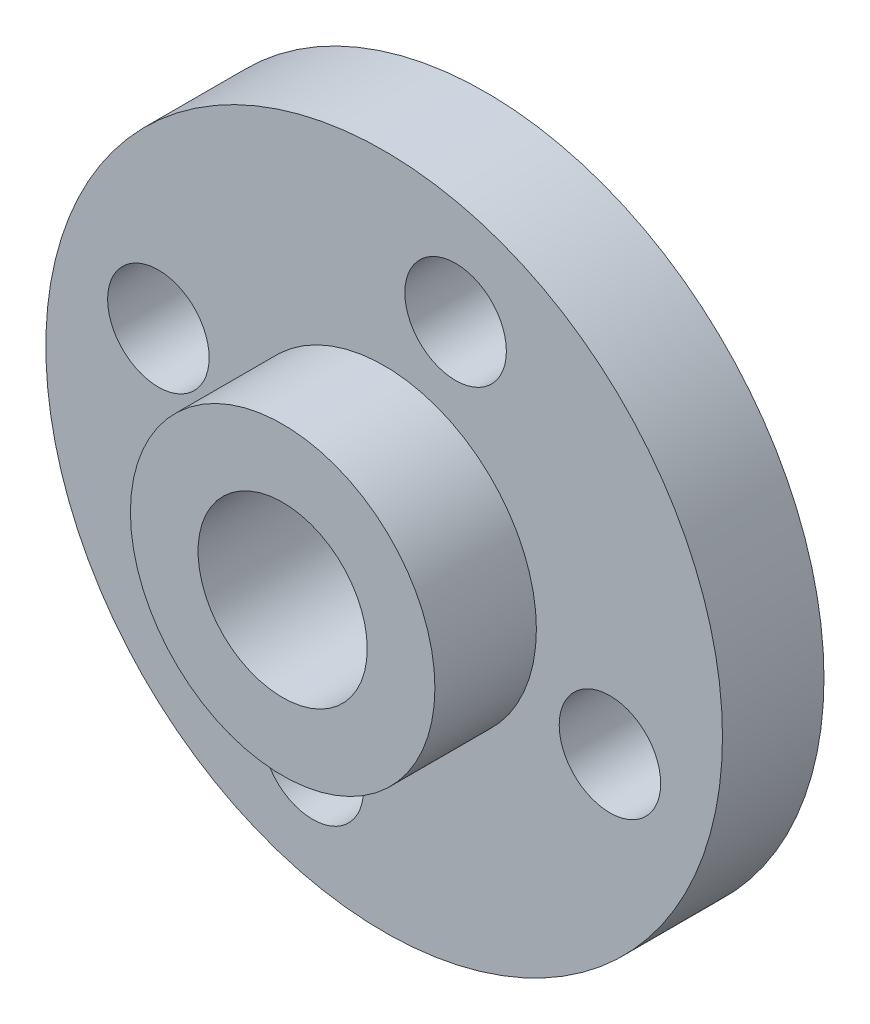
from build123d import *

# Parameters (mm, degrees)
SKETCH1_R             = 10
BOSS_EXTRUDE1_DEPTH   = 3
SKETCH2_R             = 4.5
BOSS_EXTRUDE2_DEPTH   = 3
F_3_0MM_DOWEL_HOLE1_D = 3
F_5_0MM_DOWEL_HOLE1_D = 5


with BuildPart() as part:
    # Sketch1 → Boss-Extrude1 (new body)
    with BuildSketch(Plane.XY):
        Circle(SKETCH1_R)
    extrude(amount=BOSS_EXTRUDE1_DEPTH)

    # Sketch2 → Boss-Extrude2 (add)
    with BuildSketch(Plane.XY.offset(3)):
        Circle(SKETCH2_R)
    extrude(amount=BOSS_EXTRUDE2_DEPTH)

    # Ø3.0mm Dowel Hole1 (through all)
    with Locations(Plane(origin=(0, 0, 0), x_dir=(-1, 0, 0), z_dir=(0, 0, -1))):
        with Locations((6.673703276, 2.112270007), (2.112270007, -6.673703276), (-6.673703276, -2.112270007), (-2.112270007, 6.673703276)):
            Hole(F_3_0MM_DOWEL_HOLE1_D / 2)

    # Ø5.0mm Dowel Hole1 (through all)
    with Locations(Plane.XY.offset(6)):
        with Locations((0, 0)):
            Hole(F_5_0MM_DOWEL_HOLE1_D / 2)


solid = part.part
